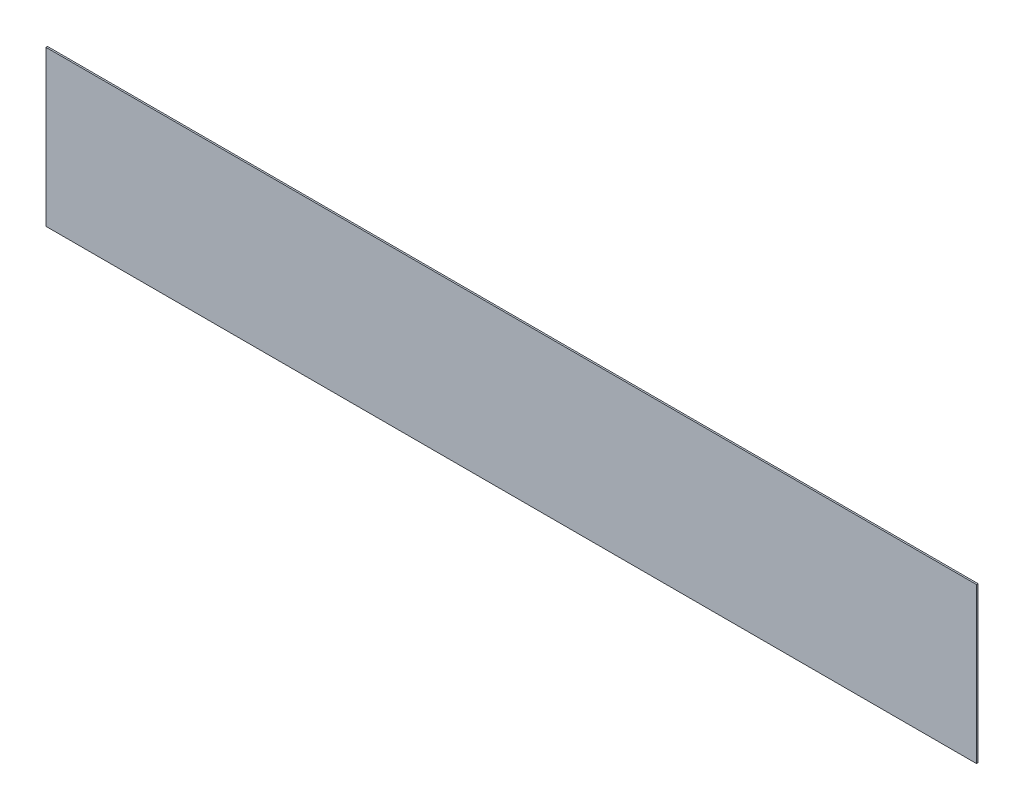
from build123d import *

# Parameters (mm, degrees)
SKETCH2_W           = 6000
SKETCH2_H           = 1000
BOSS_EXTRUDE3_DEPTH = 10


with BuildPart() as part:
    # Sketch2 → Boss-Extrude3 (new body)
    with BuildSketch(Plane.XY):
        Rectangle(SKETCH2_W, SKETCH2_H)
    extrude(amount=BOSS_EXTRUDE3_DEPTH)


solid = part.part
